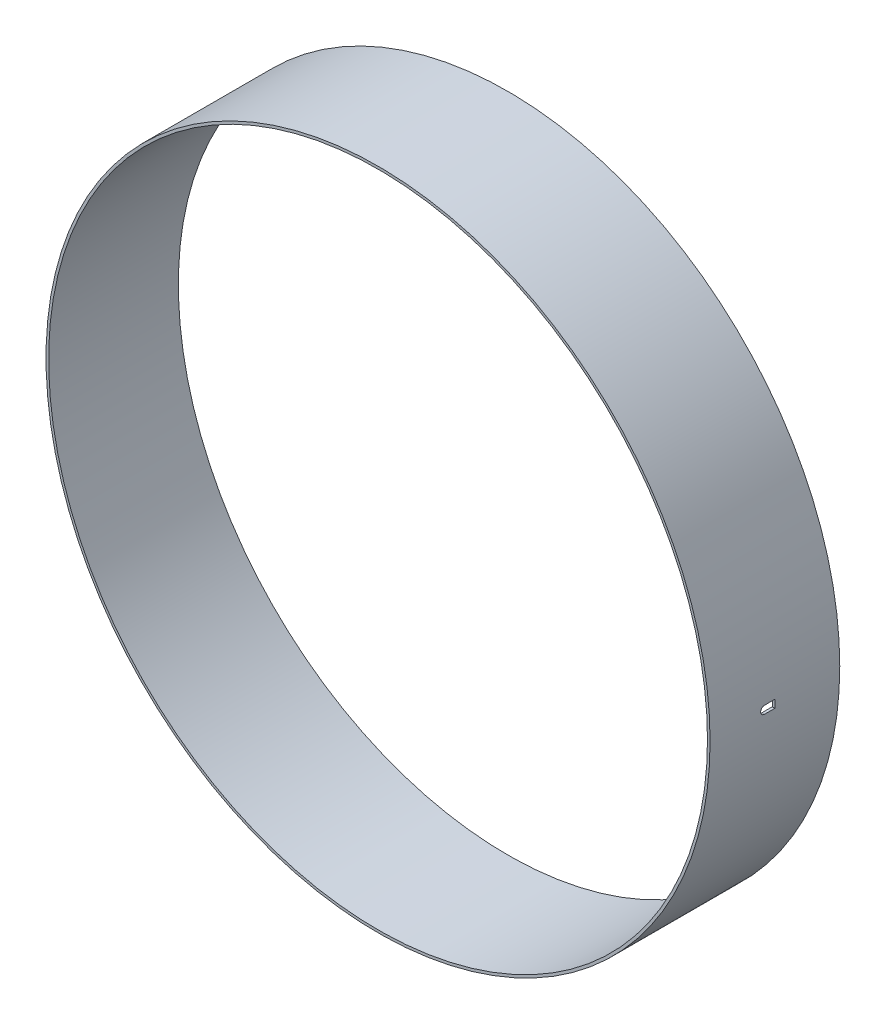
from build123d import *

# Parameters (mm, degrees)
SKETCH_1_R          = 64
SKETCH_1_R_2        = 63.5
EXTRUDE_1_DEPTH     = 25
CUT_EXTRUDE_1_DEPTH = 2000


with BuildPart() as part:
    # 草图1 → 凸台-拉伸1 (new body)
    with BuildSketch(Plane.XY):
        Circle(SKETCH_1_R)
        Circle(SKETCH_1_R_2, mode=Mode.SUBTRACT)
    extrude(amount=EXTRUDE_1_DEPTH)

    # 草图2 → 切除-拉伸1 (cut)
    with BuildSketch(Plane(origin=(0, 0, 0), x_dir=(0, 0, -1), z_dir=(1, 0, 0))):
        with BuildLine():
            Line((-14.5, -0.75), (-12.5, -0.75))
            Line((-12.5, -0.75), (-12.5, 0.75))
            Line((-12.5, 0.75), (-14.5, 0.75))
            ThreePointArc((-14.5, 0.75), (-15.25, 0), (-14.5, -0.75))
        make_face()
    extrude(amount=CUT_EXTRUDE_1_DEPTH, mode=Mode.SUBTRACT)


solid = part.part
